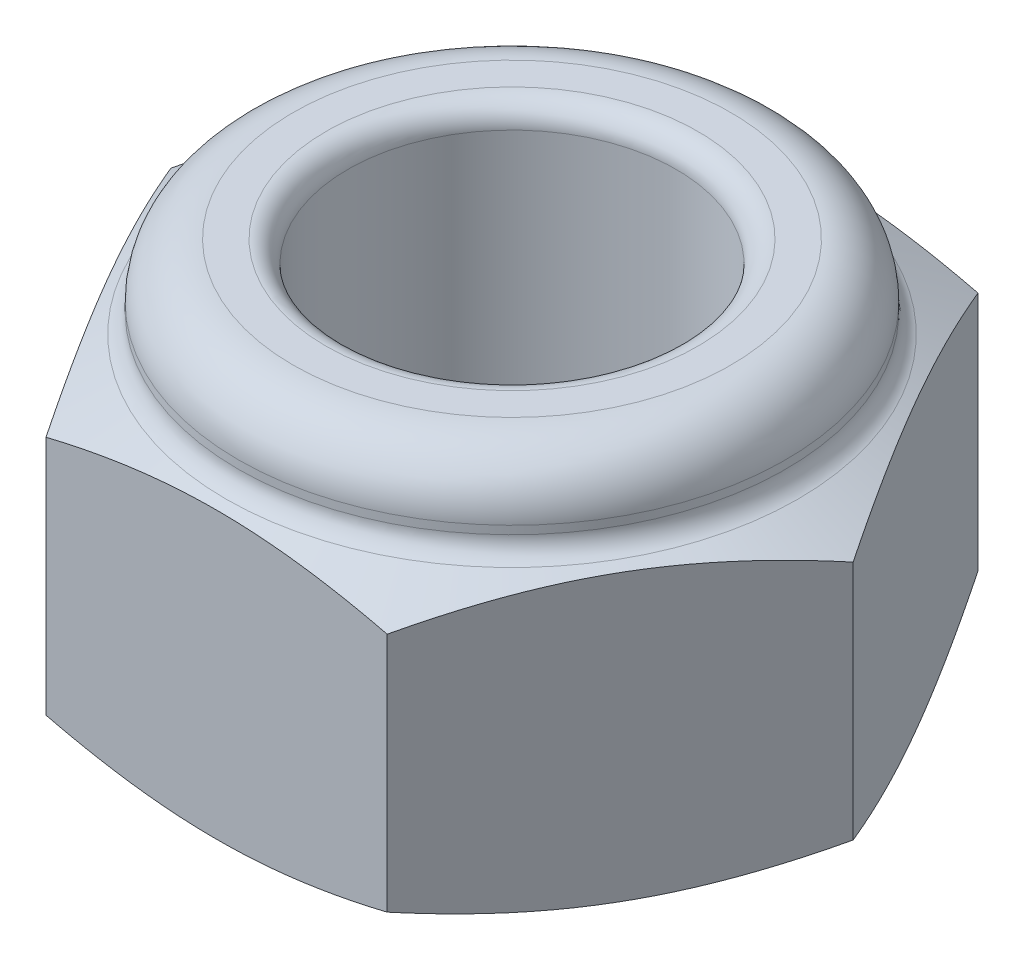
from build123d import *

# Parameters (mm, degrees)
EXTRUDE_1_DEPTH     = 1.4
SKETCH_3_R          = 1.5
CUT_EXTRUDE_1_DEPTH = 5.984977432
FILLET_1_R          = 0.2


with BuildPart() as part:
    # 草图1 → 凸台-拉伸1 (new, symmetric)
    with BuildSketch(Plane(origin=(0, 0, 0), x_dir=(1, 0, 0), z_dir=(0, 1, 0))):
        Polygon((3.117691454, 0), (1.558845727, 2.7), (-1.558845727, 2.7), (-3.117691454, 0), (-1.558845727, -2.7), (1.558845727, -2.7), align=None)
    extrude(amount=EXTRUDE_1_DEPTH, both=True)

    # 草图2 → 切除-旋转1 (revolve, cut)
    with BuildSketch(Plane.XY, mode=Mode.PRIVATE) as cut_revolve_1_sk:
        Polygon((-3.117691454, 1.1), (-2.5, 1.4), (-3.117691454, 1.4), align=None)
    cut_revolve_1 = revolve(cut_revolve_1_sk.sketch.rotate(Axis((0, 0, 0), (0, 1, 0)), 270), axis=Axis((0, 0, 0), (0, 1, 0)), mode=Mode.SUBTRACT)

    # 镜向3: 切除-旋转1 across plane
    add(cut_revolve_1.mirror(Plane.ZX), mode=Mode.SUBTRACT)

    # 草图3 → 切除-拉伸1 (cut, through all)
    with BuildSketch(Plane(origin=(0, 1.4, 0), x_dir=(1, 0, 0), z_dir=(0, 1, 0))):
        with Locations(Location((0, 0, 0), (0, 0, 270))):
            Circle(SKETCH_3_R)
    extrude(amount=-CUT_EXTRUDE_1_DEPTH, mode=Mode.SUBTRACT)

    # 草图4 → 旋转1 (revolve)
    with BuildSketch(Plane(origin=(0, 0, 0), x_dir=(0, 0, -1), z_dir=(1, 0, 0))):
        with BuildLine():
            Line((-2.5, 1.4), (-2.5, 1.6))
            ThreePointArc((-2.5, 1.6), (-2.353553391, 1.953553391), (-2, 2.1))
            Line((-2, 2.1), (-1.5, 2.1))
            Line((-1.5, 2.1), (-1.5, 1.4))
            Line((-1.5, 1.4), (-2.5, 1.4))
        make_face()
    revolve(axis=Axis((0, 1.4, 0), (0, -1, 0)))

    # 圆角1
    fillet_1_edges = [part.edges().sort_by_distance(p)[0] for p in [
        (-2.5, 1.4, 0),
        (0, 2.1, -1.5),
    ]]
    fillet(fillet_1_edges, radius=FILLET_1_R)


solid = part.part
